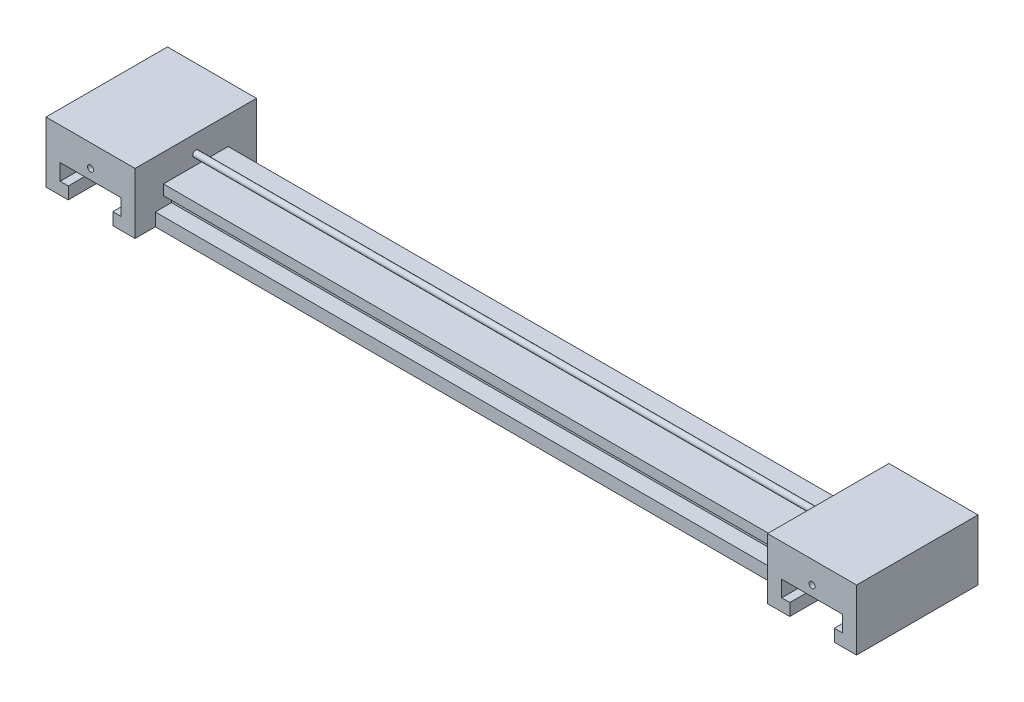
from build123d import *

# Parameters (mm, degrees)
SKETCH_1_R        = 1.5
EXTRUDE_1_DEPTH   = 60
EXTRUDE_1_2_DEPTH = 60
SKETCH_2_R        = 1.5
EXTRUDE_2_DEPTH   = 312.5


with BuildPart() as part:
    # 草图1 → 凸台-拉伸1 (new body)
    with BuildSketch(Plane.XY):
        Polygon((-231.174600935, 10.732083355), (-220.174600935, 10.732083355), (-220.174600935, 16.732083355), (-224.174600935, 16.732083355), (-224.174600935, 24.732083355), (-194.174600935, 24.732083355), (-194.174600935, 16.732083355), (-198.174600935, 16.732083355), (-198.174600935, 10.732083355), (-187.174600935, 10.732083355), (-187.174600935, 40.732083355), (-231.174600935, 40.732083355), align=None)
        with Locations((-209.174600935, 29.732083355)):
            Circle(SKETCH_1_R, mode=Mode.SUBTRACT)
    extrude(amount=EXTRUDE_1_DEPTH)

    # 草图2 → 凸台-拉伸2 (add)
    with BuildSketch(Plane(origin=(-187.174600935, 0, 0), x_dir=(0, 0, -1), z_dir=(1, 0, 0))):
        with Locations(Location((-30, 32.102498143, 0), (0, 0, 180))):
            Circle(SKETCH_2_R)
        Polygon((-10, 10.732083355), (-50, 10.732083355), (-50, 17.102498143), (-42, 17.102498143), (-42, 22.102498143), (-46, 22.102498143), (-46, 27.102498143), (-14, 27.102498143), (-14, 22.102498143), (-18, 22.102498143), (-18, 17.102498143), (-10, 17.102498143), align=None)
    extrude(amount=EXTRUDE_2_DEPTH)


with BuildPart() as body_2:
    # 草图1 → Extrude 1 2 (new body)
    with BuildSketch(Plane.XY):
        Polygon((136.325399065, 16.732083355), (136.325399065, 10.732083355), (125.325399065, 10.732083355), (125.325399065, 40.732083355), (169.325399065, 40.732083355), (169.325399065, 10.732083355), (158.325399065, 10.732083355), (158.325399065, 16.732083355), (162.325399065, 16.732083355), (162.325399065, 24.732083355), (132.325399065, 24.732083355), (132.325399065, 16.732083355), align=None)
        with Locations((147.325399065, 29.732083355)):
            Circle(SKETCH_1_R, mode=Mode.SUBTRACT)
    extrude(amount=EXTRUDE_1_2_DEPTH)


solid = Compound([part.part, body_2.part])
